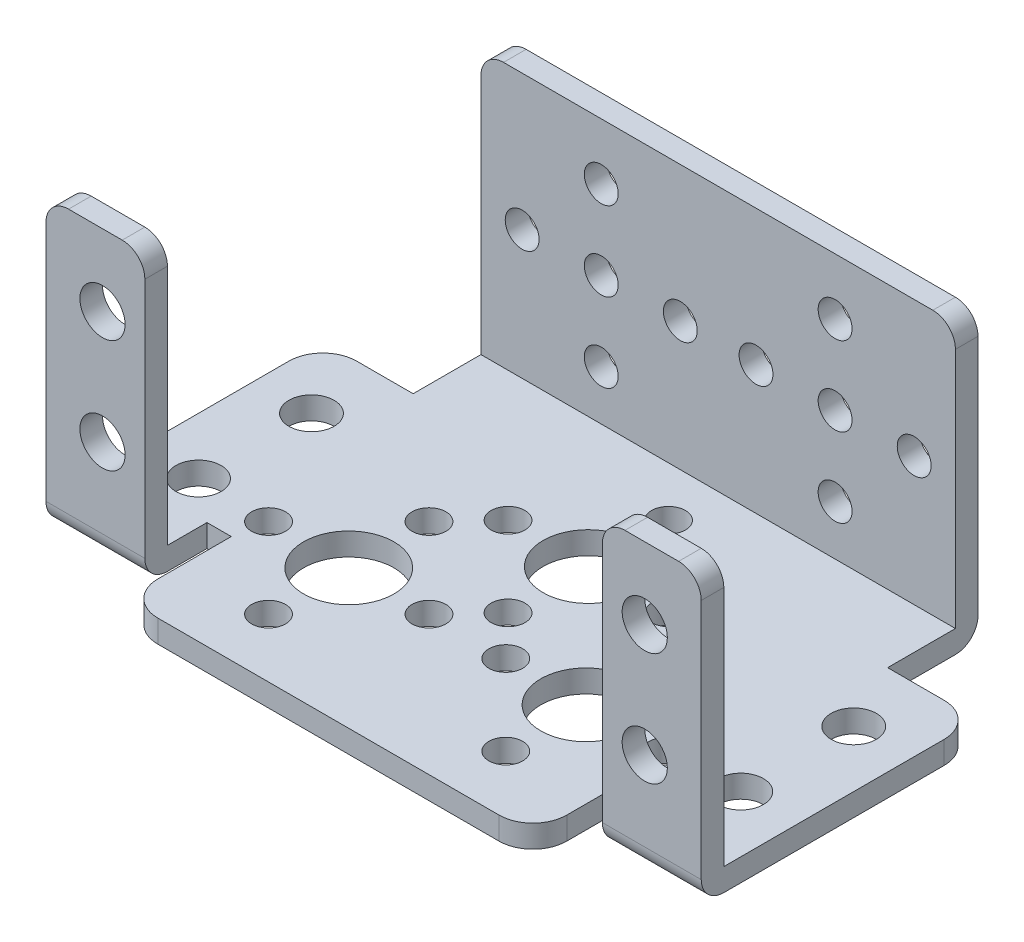
from build123d import *

# Parameters (mm, degrees)
SKETCH1_R           = 4
SKETCH1_R_2         = 1.5
SKETCH1_R_3         = 2
BOSS_EXTRUDE1_DEPTH = 2
SKETCH2_W           = 42
SKETCH2_H           = 2
SKETCH2_W_2         = 8.75
BOSS_EXTRUDE2_DEPTH = 23.4
FILLET1_R           = 2
FILLET2_R           = 2
CUT_EXTRUDE1_REACH  = 73.172
SKETCH3_R           = 2
CUT_EXTRUDE2_REACH  = 75.085
SKETCH4_R           = 1.5


with BuildPart() as part:
    # Sketch1 → Boss-Extrude1 (new body)
    with BuildSketch(Plane(origin=(0, 0, 0), x_dir=(1, 0, 0), z_dir=(0, 1, 0))):
        with BuildLine():
            Line((0, 4), (0, 25.5))
            ThreePointArc((0, 25.5), (0.878679656, 27.621320344), (3, 28.5))
            Line((3, 28.5), (8, 28.5))
            Line((8, 28.5), (8, 36.5))
            Line((8, 36.5), (50, 36.5))
            Line((50, 36.5), (50, 28.5))
            Line((50, 28.5), (55, 28.5))
            ThreePointArc((55, 28.5), (57.121320344, 27.621320344), (58, 25.5))
            Line((58, 25.5), (58, 4))
            Line((58, 4), (49.25, 4))
            Line((49.25, 4), (49.25, 9.5))
            Line((49.25, 9.5), (47.1, 9.5))
            Line((47.1, 9.5), (47.1, 3))
            ThreePointArc((47.1, 3), (46.221320344, 0.878679656), (44.1, 0))
            Line((44.1, 0), (13.9, 0))
            ThreePointArc((13.9, 0), (11.778679656, 0.878679656), (10.9, 3))
            Line((10.9, 3), (10.9, 9.5))
            Line((10.9, 9.5), (8.75, 9.5))
            Line((8.75, 9.5), (8.75, 4))
            Line((8.75, 4), (0, 4))
        make_face()
        with Locations(Location((39.5, 12.3, 0), (0, 0, 270))):
            Circle(SKETCH1_R, mode=Mode.SUBTRACT)
        with Locations(Location((18.5, 12.3, 0), (0, 0, 90))):
            Circle(SKETCH1_R, mode=Mode.SUBTRACT)
        with Locations(Location((18.5, 19.4, 0), (0, 0, 270))):
            Circle(SKETCH1_R_2, mode=Mode.SUBTRACT)
        with Locations(Location((39.5, 19.4, 0), (0, 0, 270))):
            Circle(SKETCH1_R_2, mode=Mode.SUBTRACT)
        with Locations(Location((46.6, 12.3, 0), (0, 0, 270))):
            Circle(SKETCH1_R_2, mode=Mode.SUBTRACT)
        with Locations(Location((39.5, 5.2, 0), (0, 0, 270))):
            Circle(SKETCH1_R_2, mode=Mode.SUBTRACT)
        with Locations(Location((32.4, 12.3, 0), (0, 0, 270))):
            Circle(SKETCH1_R_2, mode=Mode.SUBTRACT)
        with Locations(Location((25.6, 12.3, 0), (0, 0, 270))):
            Circle(SKETCH1_R_2, mode=Mode.SUBTRACT)
        with Locations(Location((18.5, 5.2, 0), (0, 0, 270))):
            Circle(SKETCH1_R_2, mode=Mode.SUBTRACT)
        with Locations(Location((11.4, 12.3, 0), (0, 0, 270))):
            Circle(SKETCH1_R_2, mode=Mode.SUBTRACT)
        with Locations(Location((29, 23, 0), (0, 0, 270))):
            Circle(SKETCH1_R, mode=Mode.SUBTRACT)
        with Locations(Location((29, 30.1, 0), (0, 0, 270))):
            Circle(SKETCH1_R_2, mode=Mode.SUBTRACT)
        with Locations(Location((36.1, 23, 0), (0, 0, 270))):
            Circle(SKETCH1_R_2, mode=Mode.SUBTRACT)
        with Locations(Location((29, 15.9, 0), (0, 0, 270))):
            Circle(SKETCH1_R_2, mode=Mode.SUBTRACT)
        with Locations(Location((21.9, 23, 0), (0, 0, 270))):
            Circle(SKETCH1_R_2, mode=Mode.SUBTRACT)
        with Locations(Location((53, 22.5, 0), (0, 0, 270))):
            Circle(SKETCH1_R_3, mode=Mode.SUBTRACT)
        with Locations(Location((5, 22.5, 0), (0, 0, 90))):
            Circle(SKETCH1_R_3, mode=Mode.SUBTRACT)
        with Locations(Location((53, 12.5, 0), (0, 0, 270))):
            Circle(SKETCH1_R_3, mode=Mode.SUBTRACT)
        with Locations(Location((5, 12.5, 0), (0, 0, 90))):
            Circle(SKETCH1_R_3, mode=Mode.SUBTRACT)
    extrude(amount=BOSS_EXTRUDE1_DEPTH)

    # Sketch2 → Boss-Extrude2 (add)
    with BuildSketch(Plane(origin=(0, 2, 0), x_dir=(1, 0, 0), z_dir=(0, 1, 0))):
        with Locations((29, 35.5)):
            Rectangle(SKETCH2_W, SKETCH2_H)
        with Locations((4.375, 5)):
            Rectangle(SKETCH2_W_2, SKETCH2_H)
        with Locations((53.625, 5)):
            Rectangle(SKETCH2_W_2, SKETCH2_H)
    extrude(amount=BOSS_EXTRUDE2_DEPTH)

    # Fillet1
    fillet1_edges = [part.edges().sort_by_distance(p)[0] for p in [
        (8, 25.4, -35.5),
        (50, 25.4, -35.5),
        (0, 25.4, -5),
        (8.75, 25.4, -5),
        (49.25, 25.4, -5),
        (58, 25.4, -5),
    ]]
    fillet(fillet1_edges, radius=FILLET1_R)

    # Fillet2
    fillet2_edges = [part.edges().sort_by_distance(p)[0] for p in [
        (53.625, 0, -4),
        (4.375, 0, -4),
        (29, 0, -36.5),
    ]]
    fillet(fillet2_edges, radius=FILLET2_R)

    # Sketch3 → Cut-Extrude1 (cut, up to next)
    with BuildSketch(Plane.XY.offset(-4), mode=Mode.PRIVATE) as cut_extrude1_sk1:
        with Locations((5, 19.05)):
            Circle(SKETCH3_R)
    cut_extrude1_tool1 = extrude(cut_extrude1_sk1.sketch, amount=-CUT_EXTRUDE1_REACH, mode=Mode.PRIVATE) & part.part
    # Sketch3 → Cut-Extrude1 (cut, up to next)
    with BuildSketch(Plane.XY.offset(-4), mode=Mode.PRIVATE) as cut_extrude1_sk2:
        with Locations((5, 9.05)):
            Circle(SKETCH3_R)
    cut_extrude1_tool2 = extrude(cut_extrude1_sk2.sketch, amount=-CUT_EXTRUDE1_REACH, mode=Mode.PRIVATE) & part.part
    # Sketch3 → Cut-Extrude1 (cut, up to next)
    with BuildSketch(Plane.XY.offset(-4), mode=Mode.PRIVATE) as cut_extrude1_sk3:
        with Locations((53, 9.05)):
            Circle(SKETCH3_R)
    cut_extrude1_tool3 = extrude(cut_extrude1_sk3.sketch, amount=-CUT_EXTRUDE1_REACH, mode=Mode.PRIVATE) & part.part
    # Sketch3 → Cut-Extrude1 (cut, up to next)
    with BuildSketch(Plane.XY.offset(-4), mode=Mode.PRIVATE) as cut_extrude1_sk4:
        with Locations((53, 19.05)):
            Circle(SKETCH3_R)
    cut_extrude1_tool4 = extrude(cut_extrude1_sk4.sketch, amount=-CUT_EXTRUDE1_REACH, mode=Mode.PRIVATE) & part.part
    add(cut_extrude1_tool1.solids().sort_by_distance((5, 19.05, -4))[0], mode=Mode.SUBTRACT)
    add(cut_extrude1_tool2.solids().sort_by_distance((5, 9.05, -4))[0], mode=Mode.SUBTRACT)
    add(cut_extrude1_tool3.solids().sort_by_distance((53, 9.05, -4))[0], mode=Mode.SUBTRACT)
    add(cut_extrude1_tool4.solids().sort_by_distance((53, 19.05, -4))[0], mode=Mode.SUBTRACT)

    # Sketch4 → Cut-Extrude2 (cut, up to next)
    with BuildSketch(Plane(origin=(0, 0, -36.5), x_dir=(-1, 0, 0), z_dir=(0, 0, -1)), mode=Mode.PRIVATE) as cut_extrude2_sk1:
        with Locations((-18.65, 13.4)):
            Circle(SKETCH4_R)
    cut_extrude2_tool1 = extrude(cut_extrude2_sk1.sketch, amount=-CUT_EXTRUDE2_REACH, mode=Mode.PRIVATE) & part.part
    # Sketch4 → Cut-Extrude2 (cut, up to next)
    with BuildSketch(Plane(origin=(0, 0, -36.5), x_dir=(-1, 0, 0), z_dir=(0, 0, -1)), mode=Mode.PRIVATE) as cut_extrude2_sk2:
        with Locations((-18.65, 20.4)):
            Circle(SKETCH4_R)
    cut_extrude2_tool2 = extrude(cut_extrude2_sk2.sketch, amount=-CUT_EXTRUDE2_REACH, mode=Mode.PRIVATE) & part.part
    # Sketch4 → Cut-Extrude2 (cut, up to next)
    with BuildSketch(Plane(origin=(0, 0, -36.5), x_dir=(-1, 0, 0), z_dir=(0, 0, -1)), mode=Mode.PRIVATE) as cut_extrude2_sk3:
        with Locations((-11.65, 13.4)):
            Circle(SKETCH4_R)
    cut_extrude2_tool3 = extrude(cut_extrude2_sk3.sketch, amount=-CUT_EXTRUDE2_REACH, mode=Mode.PRIVATE) & part.part
    # Sketch4 → Cut-Extrude2 (cut, up to next)
    with BuildSketch(Plane(origin=(0, 0, -36.5), x_dir=(-1, 0, 0), z_dir=(0, 0, -1)), mode=Mode.PRIVATE) as cut_extrude2_sk4:
        with Locations((-18.65, 6.4)):
            Circle(SKETCH4_R)
    cut_extrude2_tool4 = extrude(cut_extrude2_sk4.sketch, amount=-CUT_EXTRUDE2_REACH, mode=Mode.PRIVATE) & part.part
    # Sketch4 → Cut-Extrude2 (cut, up to next)
    with BuildSketch(Plane(origin=(0, 0, -36.5), x_dir=(-1, 0, 0), z_dir=(0, 0, -1)), mode=Mode.PRIVATE) as cut_extrude2_sk5:
        with Locations((-25.65, 13.4)):
            Circle(SKETCH4_R)
    cut_extrude2_tool5 = extrude(cut_extrude2_sk5.sketch, amount=-CUT_EXTRUDE2_REACH, mode=Mode.PRIVATE) & part.part
    # Sketch4 → Cut-Extrude2 (cut, up to next)
    with BuildSketch(Plane(origin=(0, 0, -36.5), x_dir=(-1, 0, 0), z_dir=(0, 0, -1)), mode=Mode.PRIVATE) as cut_extrude2_sk6:
        with Locations((-39.35, 6.4)):
            Circle(SKETCH4_R)
    cut_extrude2_tool6 = extrude(cut_extrude2_sk6.sketch, amount=-CUT_EXTRUDE2_REACH, mode=Mode.PRIVATE) & part.part
    # Sketch4 → Cut-Extrude2 (cut, up to next)
    with BuildSketch(Plane(origin=(0, 0, -36.5), x_dir=(-1, 0, 0), z_dir=(0, 0, -1)), mode=Mode.PRIVATE) as cut_extrude2_sk7:
        with Locations((-46.35, 13.4)):
            Circle(SKETCH4_R)
    cut_extrude2_tool7 = extrude(cut_extrude2_sk7.sketch, amount=-CUT_EXTRUDE2_REACH, mode=Mode.PRIVATE) & part.part
    # Sketch4 → Cut-Extrude2 (cut, up to next)
    with BuildSketch(Plane(origin=(0, 0, -36.5), x_dir=(-1, 0, 0), z_dir=(0, 0, -1)), mode=Mode.PRIVATE) as cut_extrude2_sk8:
        with Locations((-39.35, 13.4)):
            Circle(SKETCH4_R)
    cut_extrude2_tool8 = extrude(cut_extrude2_sk8.sketch, amount=-CUT_EXTRUDE2_REACH, mode=Mode.PRIVATE) & part.part
    # Sketch4 → Cut-Extrude2 (cut, up to next)
    with BuildSketch(Plane(origin=(0, 0, -36.5), x_dir=(-1, 0, 0), z_dir=(0, 0, -1)), mode=Mode.PRIVATE) as cut_extrude2_sk9:
        with Locations((-39.35, 20.4)):
            Circle(SKETCH4_R)
    cut_extrude2_tool9 = extrude(cut_extrude2_sk9.sketch, amount=-CUT_EXTRUDE2_REACH, mode=Mode.PRIVATE) & part.part
    # Sketch4 → Cut-Extrude2 (cut, up to next)
    with BuildSketch(Plane(origin=(0, 0, -36.5), x_dir=(-1, 0, 0), z_dir=(0, 0, -1)), mode=Mode.PRIVATE) as cut_extrude2_sk10:
        with Locations((-32.35, 13.4)):
            Circle(SKETCH4_R)
    cut_extrude2_tool10 = extrude(cut_extrude2_sk10.sketch, amount=-CUT_EXTRUDE2_REACH, mode=Mode.PRIVATE) & part.part
    add(cut_extrude2_tool1.solids().sort_by_distance((18.65, 13.4, -36.5))[0], mode=Mode.SUBTRACT)
    add(cut_extrude2_tool2.solids().sort_by_distance((18.65, 20.4, -36.5))[0], mode=Mode.SUBTRACT)
    add(cut_extrude2_tool3.solids().sort_by_distance((11.65, 13.4, -36.5))[0], mode=Mode.SUBTRACT)
    add(cut_extrude2_tool4.solids().sort_by_distance((18.65, 6.4, -36.5))[0], mode=Mode.SUBTRACT)
    add(cut_extrude2_tool5.solids().sort_by_distance((25.65, 13.4, -36.5))[0], mode=Mode.SUBTRACT)
    add(cut_extrude2_tool6.solids().sort_by_distance((39.35, 6.4, -36.5))[0], mode=Mode.SUBTRACT)
    add(cut_extrude2_tool7.solids().sort_by_distance((46.35, 13.4, -36.5))[0], mode=Mode.SUBTRACT)
    add(cut_extrude2_tool8.solids().sort_by_distance((39.35, 13.4, -36.5))[0], mode=Mode.SUBTRACT)
    add(cut_extrude2_tool9.solids().sort_by_distance((39.35, 20.4, -36.5))[0], mode=Mode.SUBTRACT)
    add(cut_extrude2_tool10.solids().sort_by_distance((32.35, 13.4, -36.5))[0], mode=Mode.SUBTRACT)


solid = part.part
